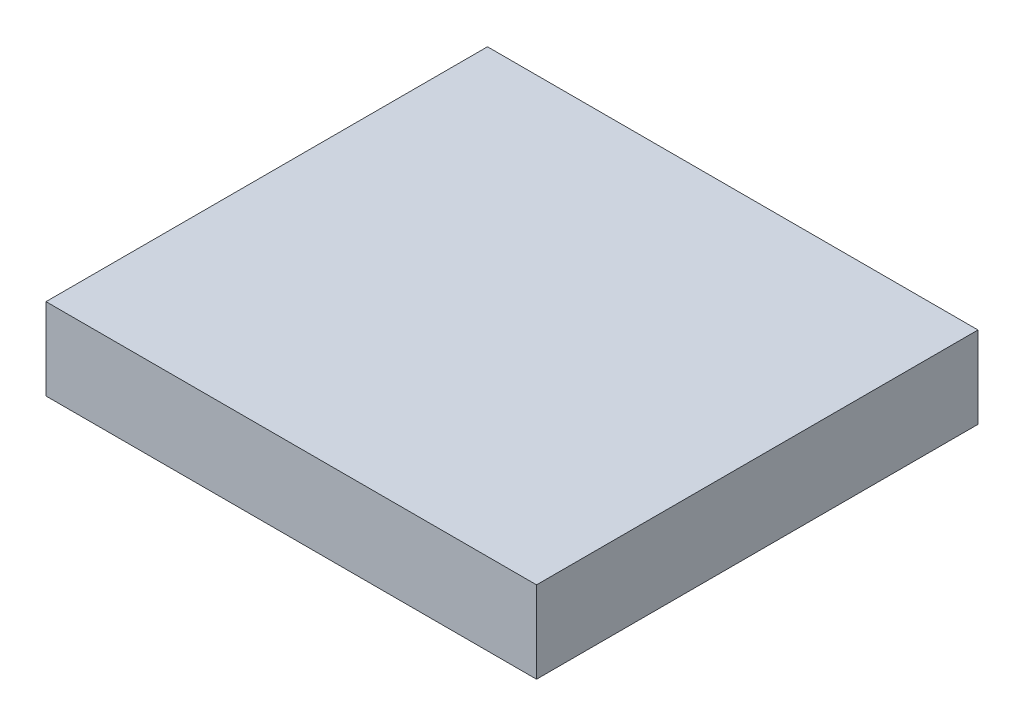
from build123d import *

# Parameters (mm, degrees)
SKETCH_1_W      = 60
SKETCH_1_H      = 54
EXTRUDE_1_DEPTH = 10


with BuildPart() as part:
    # 草图1 → 凸台-拉伸1 (new body)
    with BuildSketch(Plane(origin=(0, 0, 0), x_dir=(1, 0, 0), z_dir=(0, 1, 0))):
        with Locations((30, -27)):
            Rectangle(SKETCH_1_W, SKETCH_1_H)
    extrude(amount=EXTRUDE_1_DEPTH)


solid = part.part
